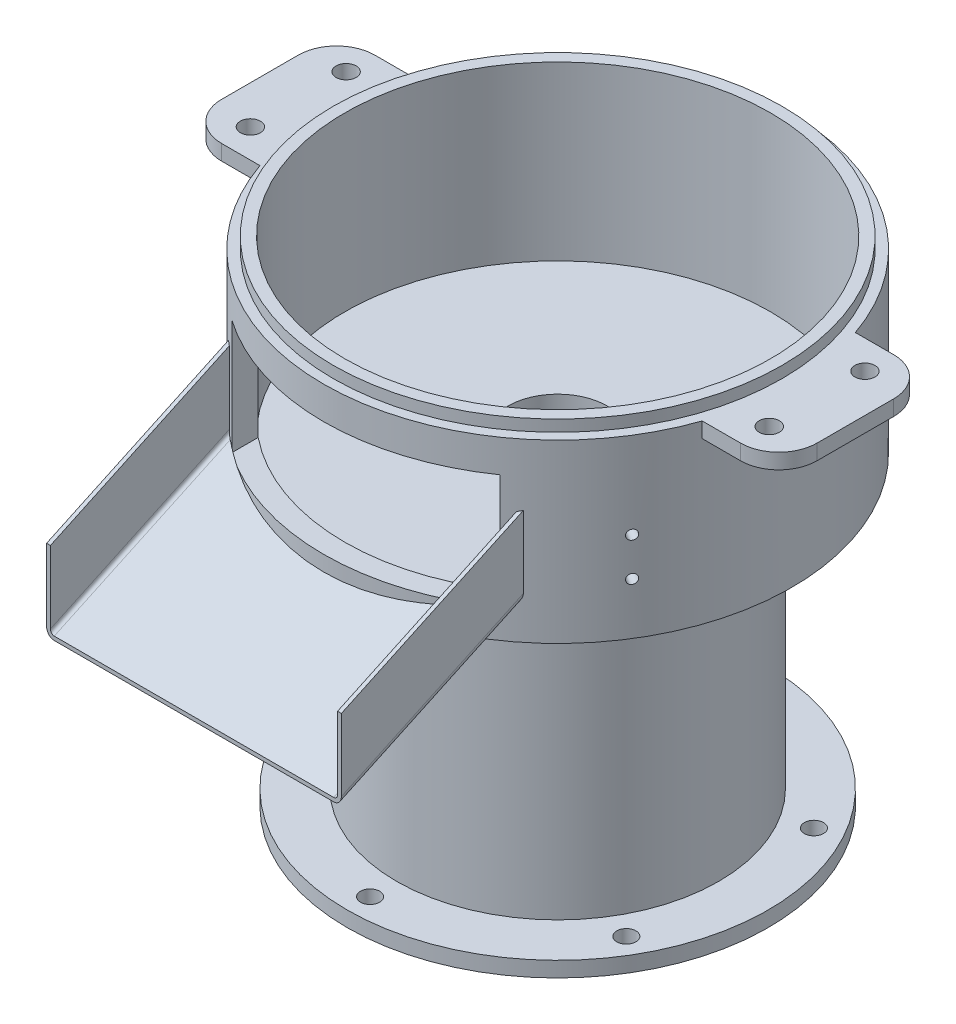
from build123d import *

# Parameters (mm, degrees)
SKETCH1_W                = 48.15
SKETCH1_H                = 152
CUT_EXTRUDE1_START       = 86.467118
SKETCH2_W                = 140
SKETCH2_H                = 60
CUT_EXTRUDE1_DEPTH       = 35.782882
SKETCH3_R                = 5
CUT_EXTRUDE2_DEPTH       = 8
CIRPATTERN1_COUNT        = 6
BOSS_EXTRUDE1_START      = -8
SKETCH4_R                = 5.25
BOSS_EXTRUDE1_DEPTH      = 8
FILLET1_R                = 20
BOSS_EXTRUDE2_REACH      = 480.939
BOSS_EXTRUDE2_END_RADIUS = 122.25
CUT_EXTRUDE3_REACH       = 412.764
CUT_EXTRUDE3_END_RADIUS  = 111.25
SKETCH8_R                = 2.5
FILLET2_R                = 2
FILLET3_R                = 4


with BuildPart() as part:
    # Sketch1 → Revolve1 (revolve)
    with BuildSketch(Plane.XY, mode=Mode.PRIVATE) as revolve1_sk:
        Polygon((84.15, -250), (110, -250), (110, -258), (19, -258), (19, -244.25), (21, -244.25), (21, -106.25), (26, -106.25), (26, -90), (111.25, -90), (111.25, 0), (117.25, 0), (117.25, -6), (122.25, -6), (122.25, -98), (84.15, -98), align=None)
        with Locations((54.075, -174)):
            Rectangle(SKETCH1_W, SKETCH1_H, mode=Mode.SUBTRACT)
    revolve(revolve1_sk.sketch.rotate(Axis((0, 0, 0), (0, -1, 0)), 90), axis=Axis((0, 0, 0), (0, -1, 0)))

    # Sketch2 → Cut-Extrude1 (cut)
    with BuildSketch(Plane.XY.offset(CUT_EXTRUDE1_START)):
        with Locations((0, -53)):
            Rectangle(SKETCH2_W, SKETCH2_H)
    extrude(amount=CUT_EXTRUDE1_DEPTH, mode=Mode.SUBTRACT)

    # Sketch3 → Cut-Extrude2 (cut)
    with BuildSketch(Plane.XZ.offset(258)):
        with Locations(Location((0, 98, 0), (0, 0, 270))):
            Circle(SKETCH3_R)
    cut_extrude2 = extrude(amount=-CUT_EXTRUDE2_DEPTH, mode=Mode.SUBTRACT)

    # CirPattern1: Cut-Extrude2 ×6 about axis
    cirpattern1_axis = Axis((0, 0, 0), (0, 1, 0))
    for i in range(1, CIRPATTERN1_COUNT):
        add(cut_extrude2.rotate(cirpattern1_axis, i * 360 / CIRPATTERN1_COUNT), mode=Mode.SUBTRACT)

    # Sketch4 → Boss-Extrude1 (add)
    # profile 1 of 2: a face of its own
    with BuildSketch(Plane(origin=(0, -6, 0), x_dir=(1, 0, 0), z_dir=(0, 1, 0)).offset(BOSS_EXTRUDE1_START)):
        with BuildLine():
            ThreePointArc((-115.520831455, -40), (-122.25, 0), (-115.520831455, 40))
            Line((-115.520831455, 40), (-155.520831455, 40))
            Line((-155.520831455, 40), (-155.520831455, -40))
            Line((-155.520831455, -40), (-115.520831455, -40))
        make_face()
        with Locations(Location((-135.520831455, -25, 0), (0, 0, 270))):
            Circle(SKETCH4_R, mode=Mode.SUBTRACT)
        with Locations(Location((-135.520831455, 25, 0), (0, 0, 270))):
            Circle(SKETCH4_R, mode=Mode.SUBTRACT)
    # profile 2 of 2: a face of its own
    with BuildSketch(Plane(origin=(0, -6, 0), x_dir=(1, 0, 0), z_dir=(0, 1, 0)).offset(BOSS_EXTRUDE1_START)):
        with BuildLine():
            Line((155.520831455, 40), (115.520831455, 40))
            ThreePointArc((115.520831455, 40), (120.555970705, 20.28103615), (122.25, 0))
            ThreePointArc((122.25, 0), (120.555970705, -20.28103615), (115.520831455, -40))
            Line((115.520831455, -40), (155.520831455, -40))
            Line((155.520831455, -40), (155.520831455, 40))
        make_face()
        with Locations(Location((135.520831455, -25, 0), (0, 0, 270))):
            Circle(SKETCH4_R, mode=Mode.SUBTRACT)
        with Locations(Location((135.520831455, 25, 0), (0, 0, 270))):
            Circle(SKETCH4_R, mode=Mode.SUBTRACT)
    extrude(amount=BOSS_EXTRUDE1_DEPTH)

    # Fillet1
    fillet1_edges = [part.edges().sort_by_distance(p)[0] for p in [
        (155.520831455, -10, -40),
        (155.520831455, -10, 40),
        (-155.520831455, -10, 40),
        (-155.520831455, -10, -40),
    ]]
    fillet(fillet1_edges, radius=FILLET1_R)

    # Cut-Extrude3: up to this cylinder (the profile starts outside it)
    cut_extrude3_end = Plane(origin=(0, -61, 0), z_dir=(0, 1, 0)) * Cylinder(CUT_EXTRUDE3_END_RADIUS, 1069.028, mode=Mode.PRIVATE)
    # Sketch8 → Cut-Extrude3 (cut, up to the surface)
    with BuildSketch(Plane(origin=(103.673879755, 0, 64.782630053), x_dir=(0, 1, 0), z_dir=(0.8480480961564272, 0, 0.529919264233203)), mode=Mode.PRIVATE) as cut_extrude3_sk1:
        with Locations(Location((-51, 0, 0), (0, 0, 270))):
            Circle(SKETCH8_R)
    cut_extrude3_tool1 = extrude(cut_extrude3_sk1.sketch, amount=-CUT_EXTRUDE3_REACH, mode=Mode.PRIVATE) - cut_extrude3_end
    add(cut_extrude3_tool1.solids().sort_by_distance((103.67388, -51, 64.78263))[0], mode=Mode.SUBTRACT)
    # Sketch8 → Cut-Extrude3 (cut, up to the surface)
    with BuildSketch(Plane(origin=(103.673879755, 0, 64.782630053), x_dir=(0, 1, 0), z_dir=(0.8480480961564272, 0, 0.529919264233203)), mode=Mode.PRIVATE) as cut_extrude3_sk2:
        with Locations(Location((-71, 0, 0), (0, 0, 270))):
            Circle(SKETCH8_R)
    cut_extrude3_tool2 = extrude(cut_extrude3_sk2.sketch, amount=-CUT_EXTRUDE3_REACH, mode=Mode.PRIVATE) - cut_extrude3_end
    add(cut_extrude3_tool2.solids().sort_by_distance((103.67388, -71, 64.78263))[0], mode=Mode.SUBTRACT)


with BuildPart() as body_2:
    # Boss-Extrude2: up to this cylinder (the profile starts outside it)
    boss_extrude2_end = Plane(origin=(0, -102.592344, 0), z_dir=(0, 1, 0)) * Cylinder(BOSS_EXTRUDE2_END_RADIUS, 1207.378, mode=Mode.PRIVATE)
    # Sketch5 → Boss-Extrude2 (new, up to the surface)
    with BuildSketch(Plane.XY.offset(190), mode=Mode.PRIVATE) as boss_extrude2_sk1:
        Polygon((-75, -122.59234384), (-75, -82.59234384), (-77, -82.59234384), (-77, -124.59234384), (77, -124.59234384), (77, -82.59234384), (75, -82.59234384), (75, -122.59234384), align=None)
    boss_extrude2_tool1 = extrude(boss_extrude2_sk1.sketch, amount=BOSS_EXTRUDE2_REACH, dir=(0, 0.422618261741, -0.906307787037), mode=Mode.PRIVATE) - boss_extrude2_end
    add(boss_extrude2_tool1.solids().sort_by_distance((76.596246, -102.592344, 190))[0])

    # Fillet2
    fillet2_edges = [body_2.edges().sort_by_distance(p)[0] for p in [
        (75, -100.80189674, 143.270235394),
        (-75, -100.80189674, 143.270235394),
    ]]
    fillet(fillet2_edges, radius=FILLET2_R)

    # Fillet3
    fillet3_edges = [body_2.edges().sort_by_distance(p)[0] for p in [
        (77, -102.431759928, 142.476474437),
        (-77, -102.431759928, 142.476474437),
    ]]
    fillet(fillet3_edges, radius=FILLET3_R)


solid = Compound([part.part, body_2.part])
